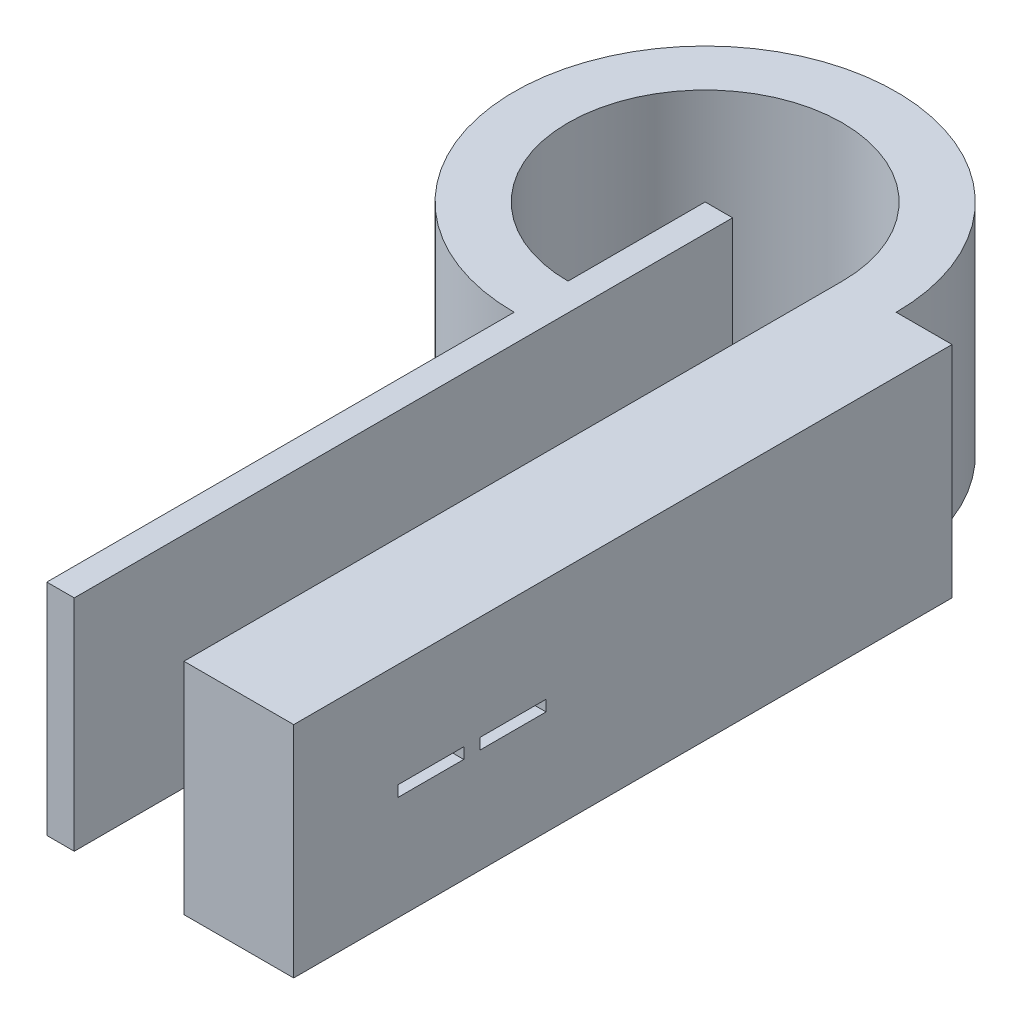
from build123d import *

# Parameters (mm, degrees)
BOSS_EXTRUDE1_DEPTH = 20
SKETCH2_R           = 4
CUT_EXTRUDE2_DEPTH  = 8
CUT_EXTRUDE4_DEPTH  = 10
SKETCH4_R           = 2.6
CUT_EXTRUDE5_DEPTH  = 1.5


with BuildPart() as part:
    # Sketch1 → Boss-Extrude1 (new body)
    with BuildSketch(Plane(origin=(0, 0, 0), x_dir=(1, 0, 0), z_dir=(0, 1, 0))):
        with BuildLine():
            Line((-41.301242739, 22.74889672), (-43.801242739, 22.74889672))
            Line((-43.801242739, 22.74889672), (-43.801242739, 10.24889672))
            ThreePointArc((-43.801242739, 10.24889672), (-52.640077504, 31.587731485), (-31.301242739, 22.74889672))
            Line((-31.301242739, 22.74889672), (-31.301242739, -37.25110328))
            Line((-31.301242739, -37.25110328), (-21.301242739, -37.25110328))
            Line((-21.301242739, -37.25110328), (-21.301242739, 22.74889672))
            Line((-21.301242739, 22.74889672), (-26.392335279, 22.74889672))
            ThreePointArc((-26.392335279, 22.74889672), (-56.111199256, 35.058853238), (-43.801242739, 5.339989261))
            Line((-43.801242739, 5.339989261), (-43.801242739, -37.25110328))
            Line((-43.801242739, -37.25110328), (-41.301242739, -37.25110328))
            Line((-41.301242739, -37.25110328), (-41.301242739, 22.74889672))
        make_face()
    extrude(amount=BOSS_EXTRUDE1_DEPTH)

    # Sketch2 → Cut-Extrude2 (cut)
    with BuildSketch(Plane.ZY.offset(31.301242739)):
        with Locations((17.25110328, 10)):
            Circle(SKETCH2_R)
    extrude(amount=-CUT_EXTRUDE2_DEPTH, mode=Mode.SUBTRACT)

    # Sketch3 → Cut-Extrude4 (cut)
    with BuildSketch(Plane(origin=(-21.301242739, 0, 0), x_dir=(0, 0, -1), z_dir=(1, 0, 0))):
        Polygon((-24.75110328, 10), (-27.75110328, 10.5), (-27.75110328, 9.5), align=None)
        Polygon((-21.75110328, 10.5), (-27.75110328, 10.5), (-24.75110328, 10), align=None)
        Polygon((-21.75110328, 10.5), (-24.75110328, 10), (-21.75110328, 9.5), align=None)
        Polygon((-21.75110328, 9.5), (-24.75110328, 10), (-27.75110328, 9.5), align=None)
        Polygon((-17.25110328, 10), (-20.25110328, 10.5), (-20.25110328, 9.5), align=None)
        Polygon((-14.25110328, 10.5), (-17.25110328, 10), (-14.25110328, 9.5), align=None)
        Polygon((-14.25110328, 10.5), (-20.25110328, 10.5), (-17.25110328, 10), align=None)
        Polygon((-14.25110328, 9.5), (-17.25110328, 10), (-20.25110328, 9.5), align=None)
    extrude(amount=-CUT_EXTRUDE4_DEPTH, mode=Mode.SUBTRACT)

    # Sketch4 → Cut-Extrude5 (cut)
    with BuildSketch(Plane.ZY.offset(31.301242739)):
        with Locations((24.75110328, 10)):
            Circle(SKETCH4_R)
    extrude(amount=-CUT_EXTRUDE5_DEPTH, mode=Mode.SUBTRACT)


solid = part.part
